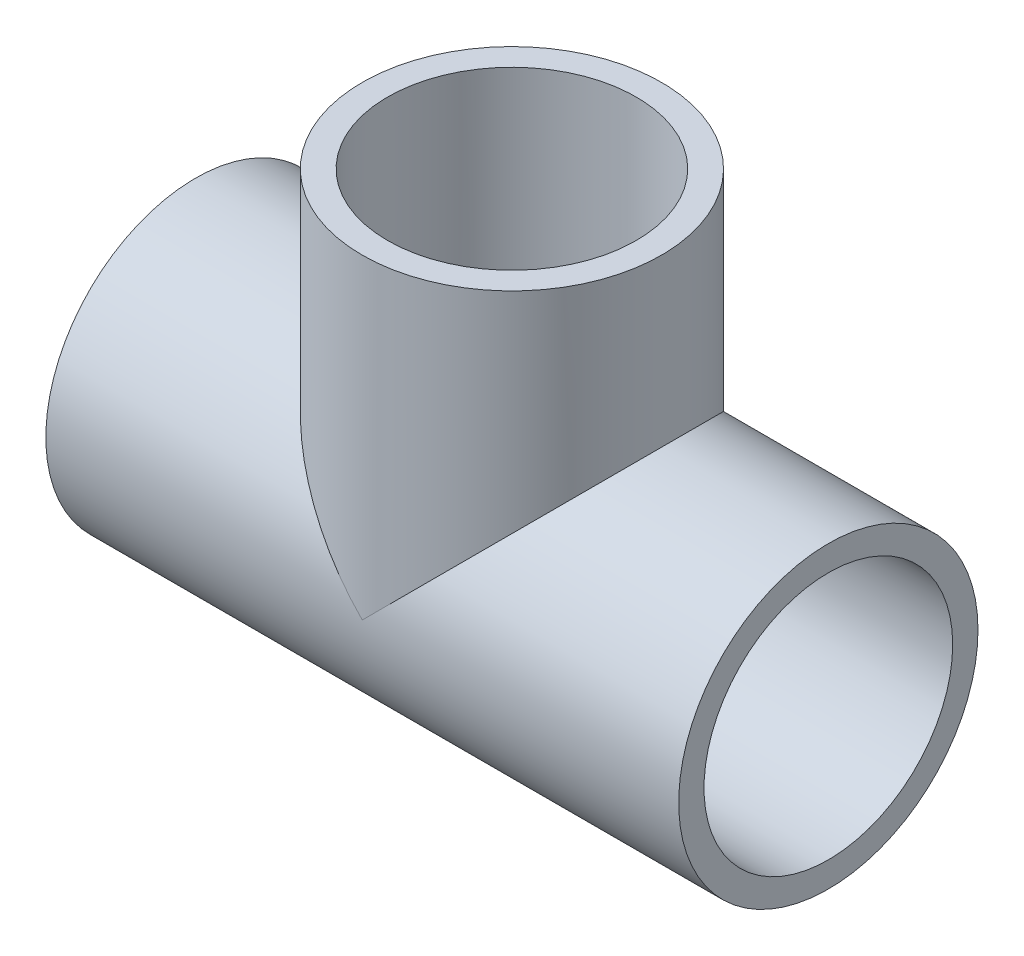
from build123d import *
from build123d.topology import SkipClean

# Parameters (mm, degrees)
CROQUIS1_R              = 20.1
CROQUIS1_R_2            = 16.7
SALIENTE_EXTRUIR1_DEPTH = 85
CROQUIS2_R              = 20.1
CROQUIS2_R_2            = 16.7
SALIENTE_EXTRUIR2_DEPTH = 42.44
CROQUIS3_R              = 16.7
CORTAR_EXTRUIR1_DEPTH   = 84.497438367
CORTAR_EXTRUIR2_START   = -42.497438367
CROQUIS5_R              = 16.7
CORTAR_EXTRUIR2_DEPTH   = 42.497438367


with BuildPart() as part:
    # Croquis1 → Saliente-Extruir1 (new body)
    with BuildSketch(Plane(origin=(0, 0, 0), x_dir=(0, 0, -1), z_dir=(1, 0, 0))):
        Circle(CROQUIS1_R)
        Circle(CROQUIS1_R_2, mode=Mode.SUBTRACT)
    extrude(amount=SALIENTE_EXTRUIR1_DEPTH)

    # Croquis2 → Saliente-Extruir2 (add)
    with BuildSketch(Plane(origin=(0, 0, 0), x_dir=(1, 0, 0), z_dir=(0, 1, 0))):
        with Locations(Location((42.5, 0, 0), (0, 0, 270))):
            Circle(CROQUIS2_R)
        with Locations(Location((42.5, 0, 0), (0, 0, 90))):
            Circle(CROQUIS2_R_2, mode=Mode.SUBTRACT)
    extrude(amount=SALIENTE_EXTRUIR2_DEPTH)

    # Croquis3 → Cortar-Extruir1 (cut)
    with SkipClean():  # the faces are left unmerged after this step: merging them gives an invalid solid
        with BuildSketch(Plane.ZY):
            with Locations(Location((0, 0, 0), (0, 0, 180))):
                Circle(CROQUIS3_R)
        extrude(amount=-CORTAR_EXTRUIR1_DEPTH, mode=Mode.SUBTRACT)

    # Croquis5 → Cortar-Extruir2 (cut)
    with SkipClean():  # the faces are left unmerged after this step: merging them gives an invalid solid
        with BuildSketch(Plane(origin=(0, 42.44, 0), x_dir=(1, 0, 0), z_dir=(0, 1, 0)).offset(CORTAR_EXTRUIR2_START)):
            with Locations(Location((42.5, 0, 0), (0, 0, 270))):
                Circle(CROQUIS5_R)
        extrude(amount=CORTAR_EXTRUIR2_DEPTH, mode=Mode.SUBTRACT)


solid = part.part
